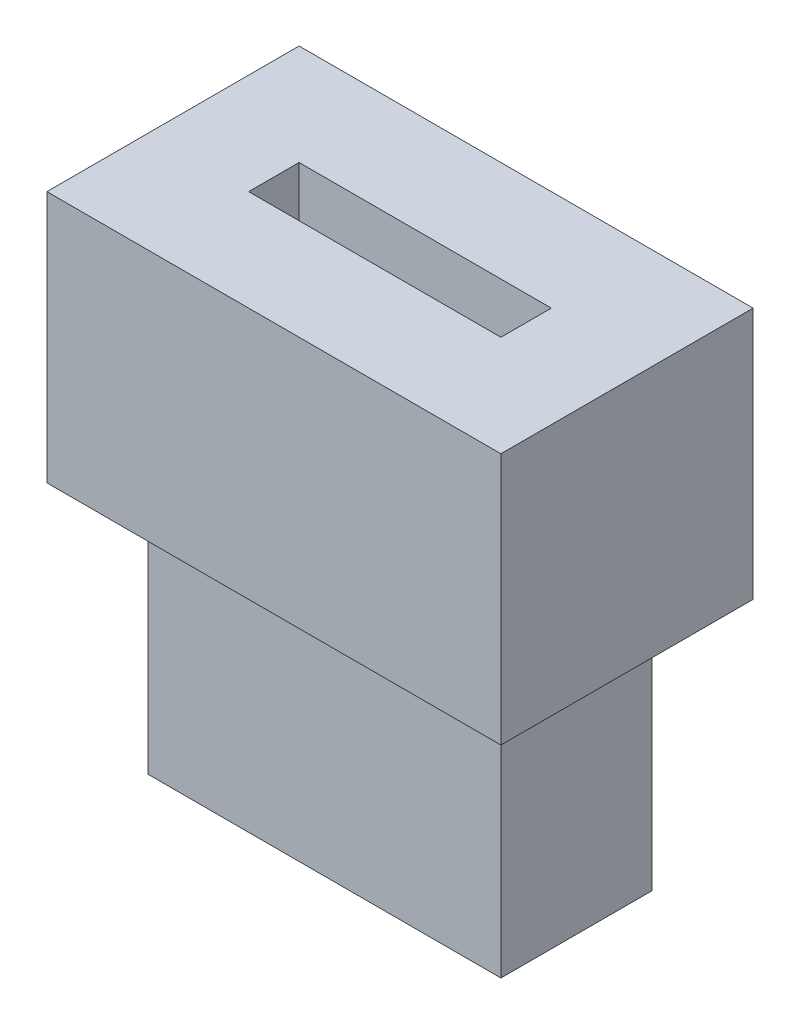
from build123d import *

# Parameters (mm, degrees)
SKETCH1_W           = 45
SKETCH1_H           = 25
SKETCH1_W_2         = 25
SKETCH1_H_2         = 5
BOSS_EXTRUDE1_DEPTH = 25
SKETCH1_3_W         = 35
SKETCH1_3_H         = 15
SKETCH1_3_W_2       = 25
SKETCH1_3_H_2       = 5
BOSS_EXTRUDE2_DEPTH = 25


with BuildPart() as part:
    # Sketch1 → Boss-Extrude1 (new body)
    with BuildSketch(Plane(origin=(0, 0, 0), x_dir=(1, 0, 0), z_dir=(0, 1, 0))):
        Rectangle(SKETCH1_W, SKETCH1_H)
        Rectangle(SKETCH1_W_2, SKETCH1_H_2, mode=Mode.SUBTRACT)
    extrude(amount=BOSS_EXTRUDE1_DEPTH)

    # Sketch1<3> → Boss-Extrude2 (add)
    with BuildSketch(Plane(origin=(0, 0, 0), x_dir=(1, 0, 0), z_dir=(0, 1, 0))):
        Rectangle(SKETCH1_3_W, SKETCH1_3_H)
        Rectangle(SKETCH1_3_W_2, SKETCH1_3_H_2, mode=Mode.SUBTRACT)
    extrude(amount=-BOSS_EXTRUDE2_DEPTH)


solid = part.part
